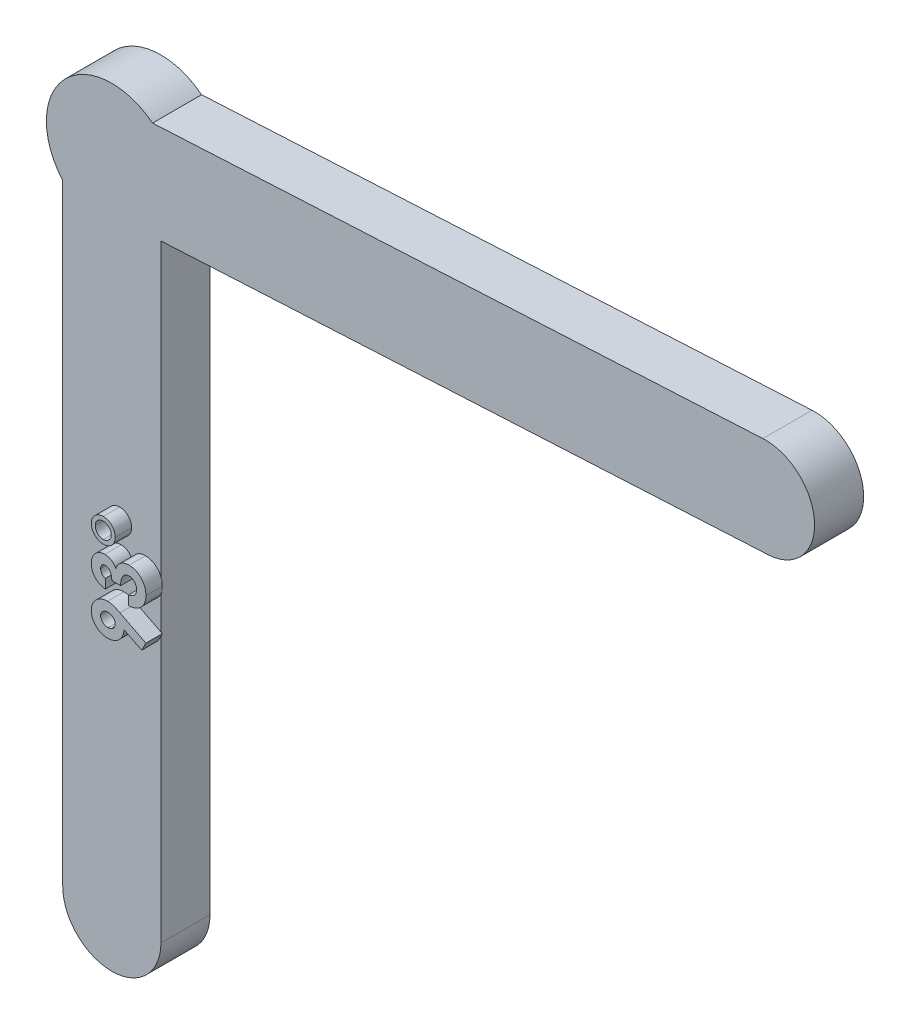
from build123d import *

# Parameters (mm, degrees)
BOSS_EXTRUDE1_DEPTH = 3
BOSS_EXTRUDE2_DEPTH = 1


with BuildPart() as part:
    # Sketch2 → Boss-Extrude1 (new body)
    with BuildSketch(Plane.XY):
        with BuildLine():
            Line((-3, -40), (-3, -2.645751311))
            ThreePointArc((-3, -2.645751311), (-2.901497484, 2.753418303), (2.485117532, 3.134356529))
            Line((2.485117532, 3.134356529), (39.788173521, 5.089326854))
            ThreePointArc((39.788173521, 5.089326854), (42.941069994, 2.250446118), (40.102189259, -0.902450355))
            Line((40.102189259, -0.902450355), (3, -2.8468937))
            Line((3, -2.8468937), (3, -40))
            ThreePointArc((3, -40), (0, -43), (-3, -40))
        make_face()
    extrude(amount=BOSS_EXTRUDE1_DEPTH)

    # Sketch3 → Boss-Extrude2 (add)
    # profile 1 of 3: a face of its own
    with BuildSketch(Plane.XY.offset(3)):
        with BuildLine():
            Line((3.081410256, -23.588450856), (2.827003205, -24.093448853))
            Line((2.827003205, -24.093448853), (1.738141026, -23.540113517))
            add(Edge.make_bspline(
                [(1.738141026, -23.540113517), (1.737307679, -23.572805789), (1.735671617, -23.636988628), (1.722077887, -23.731493709), (1.698867665, -23.821863322), (1.66798568, -23.909178369), (1.626522834, -23.992172899), (1.577200392, -24.072187069), (1.517036085, -24.147131646), (1.450419163, -24.218801512), (1.376587483, -24.283632398), (1.297699676, -24.340888916), (1.214515018, -24.38937147), (1.126474523, -24.428291226), (1.034455588, -24.458858968), (0.938097245, -24.481404343), (0.837028859, -24.494018206), (0.768247832, -24.495784735), (0.733233173, -24.49668403)],
                knots=[0, 0, 0, 0, 1.014438208, 1.991587644, 2.955575466, 3.906834206, 4.860343588, 5.829907848, 6.818577787, 7.838125475, 8.863876483, 9.862937823, 10.859547262, 11.846397878, 12.845242478, 13.865236027, 14.913246352, 16, 16, 16, 16], degree=3))
            add(Edge.make_bspline(
                [(0.733233173, -24.49668403), (0.699268433, -24.495851577), (0.632341616, -24.494211245), (0.534122537, -24.480561221), (0.439788191, -24.458163532), (0.349312599, -24.4271398), (0.263156461, -24.386739892), (0.180806411, -24.33792907), (0.102577428, -24.279980234), (0.029488987, -24.213369155), (-0.037683266, -24.141197254), (-0.095496052, -24.063553343), (-0.145955203, -23.983424749), (-0.185821936, -23.898607341), (-0.218223882, -23.810676887), (-0.240134192, -23.71842424), (-0.253941767, -23.622791914), (-0.255580842, -23.557757944), (-0.256410256, -23.524849094)],
                knots=[0, 0, 0, 0, 1.055350394, 2.079546115, 3.075301024, 4.065173222, 5.046874257, 6.027823047, 7.036058964, 8.067100199, 9.097720188, 10.095392023, 11.071904115, 12.035727154, 13.002945728, 13.979480054, 14.977565287, 16, 16, 16, 16], degree=3))
            add(Edge.make_bspline(
                [(-0.256410256, -23.524849094), (-0.25570183, -23.490446775), (-0.254308805, -23.422799269), (-0.238947683, -23.323769236), (-0.215359574, -23.22903349), (-0.183397712, -23.138149676), (-0.139790653, -23.052559556), (-0.088562765, -22.970632284), (-0.026527751, -22.893955655), (0.04326259, -22.822136546), (0.119819456, -22.757480806), (0.199293738, -22.699836555), (0.281930305, -22.65083709), (0.367786702, -22.611696418), (0.456273003, -22.580574329), (0.547584954, -22.559368449), (0.641632797, -22.54525276), (0.705408393, -22.543649359), (0.737685296, -22.542837876)],
                knots=[0, 0, 0, 0, 1.062709067, 2.08967359, 3.089490552, 4.078335371, 5.060205664, 6.052952122, 7.060109841, 8.102908433, 9.144326257, 10.153805576, 11.135063239, 12.108674621, 13.066249871, 14.029571809, 15.002763993, 16, 16, 16, 16], degree=3))
            add(Edge.make_bspline(
                [(0.737685296, -22.542837876), (0.762301574, -22.543283556), (0.81188429, -22.544181255), (0.886036554, -22.552897938), (0.960379342, -22.566305079), (1.022999032, -22.581940791), (1.075997682, -22.597668262), (1.120830704, -22.614022202), (1.170788936, -22.633745819), (1.22594926, -22.656574782), (1.286038418, -22.682692504), (1.350847586, -22.71298924), (1.421369847, -22.745551438), (1.469590593, -22.769556938), (1.494546274, -22.781980504)],
                knots=[0, 0, 0, 0, 1.105166677, 2.22605417, 3.348517788, 4.496260522, 5.122810462, 5.830557215, 6.638607343, 7.535109037, 8.511576286, 9.580928918, 10.748058253, 12, 12, 12, 12], degree=3))
            Line((1.494546274, -22.781980504), (3.081410256, -23.588450856))
        make_face()
        with BuildLine():
            add(Edge.make_bspline(
                [(1.208974359, -23.512128741), (1.207369342, -23.484820582), (1.204233503, -23.431466622), (1.179911618, -23.354865832), (1.138417283, -23.286036038), (1.082521415, -23.225660183), (1.015324017, -23.175399868), (0.938975473, -23.138571755), (0.854691699, -23.116243683), (0.795913949, -23.113910303), (0.765670072, -23.112709671)],
                knots=[0, 0, 0, 0, 0.984989413, 1.924446292, 2.868477643, 3.865502828, 4.877610339, 5.88087679, 6.909612885, 8, 8, 8, 8], degree=3))
            add(Edge.make_bspline(
                [(0.765670072, -23.112709671), (0.734793399, -23.114145334), (0.674730896, -23.116938041), (0.588284104, -23.139650292), (0.510141331, -23.178460959), (0.442213741, -23.231260652), (0.385367027, -23.292903605), (0.343842032, -23.361835986), (0.318164307, -23.436383973), (0.315039952, -23.487973789), (0.313461538, -23.514036794)],
                knots=[0, 0, 0, 0, 1.104110315, 2.147758178, 3.172670271, 4.206310416, 5.210906102, 6.157051016, 7.068948237, 8, 8, 8, 8], degree=3))
            add(Edge.make_bspline(
                [(0.313461538, -23.514036794), (0.315003347, -23.541581021), (0.318030676, -23.595663884), (0.343602738, -23.673290534), (0.384431439, -23.744526021), (0.44077104, -23.807677424), (0.508416133, -23.861065005), (0.586808982, -23.899026366), (0.672697468, -23.922819869), (0.732861373, -23.925457518), (0.763762019, -23.926812235)],
                knots=[0, 0, 0, 0, 0.970853505, 1.906262912, 2.855477211, 3.852937491, 4.877462982, 5.878766514, 6.910518104, 8, 8, 8, 8], degree=3))
            add(Edge.make_bspline(
                [(0.763762019, -23.926812235), (0.794228566, -23.92540494), (0.853482819, -23.922667898), (0.938337992, -23.899613919), (1.0154379, -23.862415398), (1.082728129, -23.810529662), (1.138908417, -23.748133904), (1.179920426, -23.676210785), (1.204301458, -23.596348705), (1.207388686, -23.540707414), (1.208974359, -23.512128741)],
                knots=[0, 0, 0, 0, 1.075841396, 2.092399178, 3.084869331, 4.085011737, 5.078048045, 6.03490933, 6.990683323, 8, 8, 8, 8], degree=3))
        make_face(mode=Mode.SUBTRACT)
    # profile 2 of 3: a face of its own
    with BuildSketch(Plane.XY.offset(3)):
        with BuildLine():
            Line((0.598397436, -21.403094286), (0.598397436, -21.972966081))
            add(Edge.make_bspline(
                [(0.598397436, -21.972966081), (0.569905344, -21.968967669), (0.514253238, -21.961157781), (0.433490113, -21.941958929), (0.35669034, -21.919756621), (0.284266078, -21.891363009), (0.216295401, -21.858587706), (0.152717485, -21.820367255), (0.092619933, -21.778475108), (0.05660533, -21.745676177), (0.038701923, -21.729371329)],
                knots=[0, 0, 0, 0, 1.1115466, 2.171125598, 3.205689823, 4.19946166, 5.17440286, 6.118867946, 7.064860634, 8, 8, 8, 8], degree=3))
            add(Edge.make_bspline(
                [(0.038701923, -21.729371329), (0.015043155, -21.705911747), (-0.031585791, -21.659675376), (-0.09131232, -21.582408976), (-0.14300157, -21.501419521), (-0.18398118, -21.41508273), (-0.217149428, -21.324742069), (-0.239428614, -21.229679117), (-0.254211051, -21.130282337), (-0.255667173, -21.062456539), (-0.256410256, -21.027843885)],
                knots=[0, 0, 0, 0, 1.01925491, 2.00884431, 2.983262333, 3.955970413, 4.92937149, 5.924503185, 6.940838805, 8, 8, 8, 8], degree=3))
            add(Edge.make_bspline(
                [(-0.256410256, -21.027843885), (-0.25568378, -20.997071455), (-0.254255673, -20.936579058), (-0.242791605, -20.847670455), (-0.222684907, -20.762903542), (-0.19639585, -20.681382309), (-0.160625195, -20.604305667), (-0.119103078, -20.52997246), (-0.068174475, -20.460459561), (-0.01063028, -20.395604322), (0.0516094, -20.336022415), (0.1181385, -20.284424223), (0.187179874, -20.240064332), (0.259307125, -20.203517648), (0.3346423, -20.175418215), (0.4127502, -20.155916375), (0.493458473, -20.143151948), (0.548314798, -20.141880277), (0.576136819, -20.141235312)],
                knots=[0, 0, 0, 0, 1.091422571, 2.145516843, 3.172569842, 4.178562979, 5.178154469, 6.181868002, 7.194278174, 8.227918432, 9.254613415, 10.245994977, 11.209837596, 12.161663635, 13.10878368, 14.055455738, 15.013766427, 16, 16, 16, 16], degree=3))
            add(Edge.make_bspline(
                [(0.576136819, -20.141235312), (0.610585958, -20.142584303), (0.678613472, -20.145248187), (0.777980899, -20.166315604), (0.8727781, -20.200182678), (0.961881861, -20.248336638), (1.045199363, -20.308807492), (1.1198207, -20.382963534), (1.186901514, -20.468735364), (1.222951204, -20.53312363), (1.241411258, -20.566095087)],
                knots=[0, 0, 0, 0, 0.992776698, 1.96045919, 2.915875678, 3.886951799, 4.871409521, 5.874469288, 6.911574252, 8, 8, 8, 8], degree=3))
            add(Edge.make_bspline(
                [(1.241411258, -20.566095087), (1.248840578, -20.543463138), (1.26343886, -20.498992374), (1.292207769, -20.435795275), (1.323580612, -20.375652592), (1.360205051, -20.319939768), (1.399542556, -20.267129011), (1.44370819, -20.218891181), (1.491568291, -20.173977176), (1.543631999, -20.133498114), (1.599033683, -20.097307955), (1.656777581, -20.065413922), (1.717074737, -20.038648834), (1.779482048, -20.016185029), (1.844613707, -19.999045768), (1.912248991, -19.986987677), (1.982224933, -19.980015534), (2.02963392, -19.978952374), (2.053605769, -19.978414799)],
                knots=[0, 0, 0, 0, 1.059375415, 2.081625174, 3.086260357, 4.075579879, 5.045586876, 6.014170127, 6.982201689, 7.963705737, 8.945119069, 9.924852636, 10.896327119, 11.878239286, 12.873838556, 13.889973282, 14.933087432, 16, 16, 16, 16], degree=3))
            add(Edge.make_bspline(
                [(2.053605769, -19.978414799), (2.088834625, -19.979504626), (2.158298755, -19.981653544), (2.260612118, -19.995315693), (2.358159557, -20.020751163), (2.452060019, -20.054216208), (2.541114181, -20.09884269), (2.627316675, -20.151405589), (2.707744153, -20.215744211), (2.783940091, -20.287893942), (2.853551958, -20.367602087), (2.915054815, -20.453373222), (2.965754166, -20.545373525), (3.00908881, -20.641378781), (3.04124993, -20.74355178), (3.064801955, -20.850570839), (3.079131724, -20.963217452), (3.080639979, -21.040097913), (3.081410256, -21.079361313)],
                knots=[0, 0, 0, 0, 1.005228408, 1.982105694, 2.937129188, 3.876607107, 4.82066901, 5.774063015, 6.75178259, 7.752926466, 8.764612432, 9.766578198, 10.757677051, 11.756882247, 12.76686714, 13.807379907, 14.880213281, 16, 16, 16, 16], degree=3))
            add(Edge.make_bspline(
                [(3.081410256, -21.079361313), (3.080599988, -21.116504647), (3.079015615, -21.189133521), (3.065302063, -21.295368449), (3.043180991, -21.396334693), (3.011999506, -21.492289919), (2.971562448, -21.582862885), (2.923410986, -21.668874941), (2.864767854, -21.748609737), (2.798280315, -21.822955674), (2.723685071, -21.890263535), (2.642710085, -21.950420912), (2.555047441, -22.002101325), (2.46107167, -22.045516715), (2.360617912, -22.080327672), (2.253890444, -22.107786453), (2.140680753, -22.126966861), (2.062790077, -22.132808294), (2.023076923, -22.135786594)],
                knots=[0, 0, 0, 0, 1.066544725, 2.085487077, 3.070979577, 4.031932826, 4.977951092, 5.916076795, 6.857635327, 7.814973522, 8.776389752, 9.738577119, 10.707772778, 11.69409279, 12.707140348, 13.757286496, 14.856535458, 16, 16, 16, 16], degree=3))
            Line((2.023076923, -22.135786594), (2.023076923, -21.565914799))
            add(Edge.make_bspline(
                [(2.023076923, -21.565914799), (2.043044885, -21.562302876), (2.081937728, -21.55526771), (2.138251456, -21.541558457), (2.190212049, -21.523646403), (2.23820125, -21.503167609), (2.282711557, -21.480525899), (2.322552685, -21.45347298), (2.359290392, -21.424466249), (2.401517912, -21.380862524), (2.445802396, -21.320025337), (2.485022762, -21.237655363), (2.507328862, -21.145608571), (2.510104057, -21.081389241), (2.511538462, -21.048196449)],
                knots=[0, 0, 0, 0, 0.928450228, 1.808400301, 2.64896863, 3.43999153, 4.194978884, 4.9294959, 5.640047715, 6.332896648, 7.70085756, 9.063442004, 10.482192841, 12, 12, 12, 12], degree=3))
            add(Edge.make_bspline(
                [(2.511538462, -21.048196449), (2.511234698, -21.030580743), (2.510639692, -20.996075515), (2.504104723, -20.945379536), (2.493216621, -20.897133951), (2.478821118, -20.850938099), (2.4592865, -20.807517963), (2.436616641, -20.765890434), (2.4088653, -20.72681679), (2.377245282, -20.690524651), (2.343480924, -20.656748783), (2.306533866, -20.627908103), (2.268178179, -20.603008504), (2.227399343, -20.583361044), (2.185484675, -20.566917336), (2.141101944, -20.556661651), (2.095214543, -20.548964589), (2.063816677, -20.548514847), (2.047881611, -20.548286594)],
                knots=[0, 0, 0, 0, 1.110702965, 2.175618623, 3.217100552, 4.227908035, 5.221854906, 6.215531843, 7.213608581, 8.237687243, 9.249555755, 10.220750668, 11.188994735, 12.127982202, 13.071814005, 14.022160605, 14.996205625, 16, 16, 16, 16], degree=3))
            add(Edge.make_bspline(
                [(2.047881611, -20.548286594), (2.030448232, -20.548867035), (1.995950897, -20.550015618), (1.945396706, -20.560123094), (1.896579334, -20.575252494), (1.849901563, -20.597011379), (1.80563791, -20.625483849), (1.763421781, -20.660103452), (1.723589285, -20.701183367), (1.684980341, -20.747347937), (1.651182253, -20.800459823), (1.620059269, -20.858374281), (1.595277703, -20.922518085), (1.57314858, -20.991352413), (1.556984463, -21.066171515), (1.545248131, -21.146513047), (1.536512134, -21.232246748), (1.535258821, -21.29134413), (1.534615385, -21.32168403)],
                knots=[0, 0, 0, 0, 0.809868251, 1.602574917, 2.388262527, 3.182133002, 3.988875265, 4.829537611, 5.714850619, 6.646378958, 7.622533229, 8.636771727, 9.698525113, 10.814716514, 11.996253919, 13.252421425, 14.589425562, 16, 16, 16, 16], degree=3))
            Line((1.534615385, -21.32168403), (1.005448718, -21.32168403))
            add(Edge.make_bspline(
                [(1.005448718, -21.32168403), (1.0022437, -21.283904446), (0.996247747, -21.213226326), (0.982028627, -21.115188777), (0.963634458, -21.032372777), (0.939661871, -20.96383172), (0.911660162, -20.905977202), (0.879215485, -20.856145419), (0.841958845, -20.812668682), (0.799944528, -20.776907251), (0.755904956, -20.747105361), (0.709066574, -20.726704395), (0.661292945, -20.713030222), (0.628592786, -20.711744288), (0.612389824, -20.711107106)],
                knots=[0, 0, 0, 0, 1.700711886, 3.181695139, 4.441392523, 5.500267777, 6.431839453, 7.31822765, 8.161090383, 8.990537424, 9.787217293, 10.536619396, 11.274893404, 12, 12, 12, 12], degree=3))
            add(Edge.make_bspline(
                [(0.612389824, -20.711107106), (0.591714502, -20.71220187), (0.551360652, -20.714338616), (0.493502791, -20.731259217), (0.441654003, -20.759974178), (0.396394238, -20.798935803), (0.359475255, -20.846800583), (0.332017035, -20.902195348), (0.315998921, -20.964839404), (0.314326488, -21.008882015), (0.313461538, -21.031659991)],
                knots=[0, 0, 0, 0, 1.009324788, 1.969988301, 2.915956825, 3.885795408, 4.868116622, 5.850437836, 6.888288533, 8, 8, 8, 8], degree=3))
            add(Edge.make_bspline(
                [(0.313461538, -21.031659991), (0.314477881, -21.052308109), (0.316494615, -21.093280298), (0.331546985, -21.153193902), (0.356885777, -21.210091864), (0.391826478, -21.26279599), (0.433788778, -21.310545482), (0.483484413, -21.34973404), (0.537936031, -21.382329224), (0.578164626, -21.396145464), (0.598397436, -21.403094286)],
                knots=[0, 0, 0, 0, 0.98818071, 1.960853194, 2.938124878, 3.957524365, 4.978590984, 5.968022688, 6.978025184, 8, 8, 8, 8], degree=3))
        make_face()
    # profile 3 of 3: a face of its own
    with BuildSketch(Plane.XY.offset(3)):
        with BuildLine():
            add(Edge.make_bspline(
                [(0.476282051, -18.187389158), (0.501543872, -18.187935652), (0.55122174, -18.189010345), (0.624352745, -18.199443644), (0.694208258, -18.21692286), (0.761803607, -18.239333507), (0.825395964, -18.270472258), (0.886396731, -18.307334006), (0.943669883, -18.351832841), (0.9978957, -18.401445138), (1.047295391, -18.455945301), (1.090947065, -18.513835657), (1.127096601, -18.575294637), (1.157366856, -18.639007417), (1.180332148, -18.705838832), (1.196689885, -18.775294755), (1.20741609, -18.847667155), (1.208449037, -18.89693404), (1.208974359, -18.921989518)],
                knots=[0, 0, 0, 0, 1.048753193, 2.062393874, 3.059725798, 4.03711221, 5.013824111, 5.993903926, 6.992478922, 8.020738441, 9.043061753, 10.043343452, 11.026424807, 11.999358773, 12.968420071, 13.955122655, 14.960044262, 16, 16, 16, 16], degree=3))
            add(Edge.make_bspline(
                [(1.208974359, -18.921989518), (1.208454225, -18.947046851), (1.207431478, -18.996317383), (1.196631189, -19.068663297), (1.180530583, -19.138285312), (1.156529218, -19.20482186), (1.126678292, -19.268586699), (1.090260147, -19.329502986), (1.046482503, -19.387031162), (0.996781055, -19.441012966), (0.942375086, -19.490537807), (0.88420218, -19.533913081), (0.823225465, -19.571376285), (0.758107997, -19.600267606), (0.69067286, -19.624377207), (0.619758864, -19.640418009), (0.545943315, -19.651263274), (0.495615647, -19.652263254), (0.469921875, -19.652773773)],
                knots=[0, 0, 0, 0, 1.037227242, 2.039512271, 3.023626077, 3.993053151, 4.963434463, 5.936395473, 6.927031705, 7.952593414, 8.972234493, 9.969891786, 10.954906455, 11.929570282, 12.915563215, 13.916770353, 14.936449251, 16, 16, 16, 16], degree=3))
            add(Edge.make_bspline(
                [(0.469921875, -19.652773773), (0.445290866, -19.65224162), (0.396869022, -19.651195466), (0.325492116, -19.640533829), (0.256787066, -19.623612944), (0.190979117, -19.599245399), (0.128167681, -19.568160417), (0.067236284, -19.531610304), (0.010175979, -19.486367581), (-0.044275745, -19.435945891), (-0.093962638, -19.380648677), (-0.137555056, -19.321952549), (-0.173973759, -19.260452189), (-0.203993097, -19.196564592), (-0.227847104, -19.130198731), (-0.244158222, -19.060841388), (-0.254789074, -18.989101702), (-0.255866772, -18.940260181), (-0.256410256, -18.915629342)],
                knots=[0, 0, 0, 0, 1.027628768, 2.020204677, 3.0054932, 3.977172113, 4.942988595, 5.928118098, 6.937247537, 7.976812879, 9.023474825, 10.036014018, 11.024160528, 12.002107364, 12.979092523, 13.962271943, 14.972371232, 16, 16, 16, 16], degree=3))
            add(Edge.make_bspline(
                [(-0.256410256, -18.915629342), (-0.255881051, -18.890996341), (-0.254836181, -18.842360577), (-0.244068832, -18.770857315), (-0.227959354, -18.701870672), (-0.203981879, -18.635954399), (-0.173948227, -18.572715286), (-0.137706982, -18.511931501), (-0.093944483, -18.454372017), (-0.043999627, -18.400449434), (0.009956511, -18.350217351), (0.068273488, -18.307057761), (0.128824771, -18.269534843), (0.192846684, -18.239885233), (0.259342082, -18.215825064), (0.329176204, -18.199664146), (0.401748506, -18.188973725), (0.451226198, -18.18792184), (0.476282051, -18.187389158)],
                knots=[0, 0, 0, 0, 1.02774298, 2.029191086, 3.012479778, 3.981238486, 4.951290381, 5.931946007, 6.930416638, 7.964088953, 8.997761269, 10.003308488, 10.98854748, 11.966603007, 12.943696749, 13.935593372, 14.954569896, 16, 16, 16, 16], degree=3))
        make_face()
        with BuildLine():
            add(Edge.make_bspline(
                [(0.479462139, -18.431619927), (0.462471258, -18.431854432), (0.428972226, -18.432316781), (0.379883793, -18.439936146), (0.332524379, -18.450453944), (0.287283463, -18.465714089), (0.24427911, -18.485664453), (0.203398935, -18.510001997), (0.164484674, -18.538605068), (0.128492582, -18.571667692), (0.095853701, -18.607534015), (0.066652511, -18.64532742), (0.042455186, -18.685516691), (0.023016589, -18.727703262), (0.006315159, -18.771232027), (-0.003707976, -18.817142093), (-0.01154919, -18.864693467), (-0.011966436, -18.897149066), (-0.012179487, -18.913721289)],
                knots=[0, 0, 0, 0, 1.061159961, 2.092171217, 3.098605391, 4.092036902, 5.070589041, 6.057187883, 7.061962211, 8.084674938, 9.107387665, 10.090954379, 11.06617917, 12.032717429, 12.99305519, 13.973669989, 14.965331307, 16, 16, 16, 16], degree=3))
            add(Edge.make_bspline(
                [(-0.012179487, -18.913721289), (-0.01157068, -18.930481581), (-0.01036426, -18.963693965), (-0.004409395, -19.012631), (0.007572839, -19.059283879), (0.022606002, -19.104485131), (0.043122897, -19.147328311), (0.067542797, -19.188821404), (0.096744971, -19.22786553), (0.129769422, -19.264644834), (0.165718261, -19.298390632), (0.204573602, -19.327380715), (0.244977971, -19.352782577), (0.287582445, -19.37288553), (0.331832846, -19.388997903), (0.377821945, -19.400639595), (0.425871214, -19.406786491), (0.458458137, -19.407951341), (0.475010016, -19.408543004)],
                knots=[0, 0, 0, 0, 1.042034071, 2.064906527, 3.055369705, 4.030203466, 5.020228521, 6.000742353, 7.017744738, 8.043920206, 9.069249762, 10.075703201, 11.051782302, 12.029903876, 12.99669358, 13.974371501, 14.971122288, 16, 16, 16, 16], degree=3))
            add(Edge.make_bspline(
                [(0.475010016, -19.408543004), (0.491349767, -19.407950314), (0.523514051, -19.406783624), (0.570936909, -19.400653331), (0.616468237, -19.388896008), (0.660506807, -19.372855568), (0.703332854, -19.352888552), (0.743356347, -19.326659428), (0.782721478, -19.297449349), (0.819574977, -19.263368492), (0.853594861, -19.226488887), (0.883277913, -19.18699337), (0.908722399, -19.146052572), (0.929101491, -19.103066515), (0.945194342, -19.058803923), (0.956841315, -19.012818121), (0.962986781, -18.964767958), (0.964151827, -18.932181159), (0.96474359, -18.915629342)],
                knots=[0, 0, 0, 0, 1.017878107, 2.003660885, 2.970612419, 3.939454555, 4.919652619, 5.904816436, 6.913406512, 7.969270601, 9.02513469, 10.033724766, 11.041277553, 12.021475617, 12.990317753, 13.970071221, 14.968938047, 16, 16, 16, 16], degree=3))
            add(Edge.make_bspline(
                [(0.96474359, -18.915629342), (0.964515736, -18.899270856), (0.964066668, -18.867030536), (0.956359019, -18.819879058), (0.946146284, -18.774219457), (0.929505189, -18.730915821), (0.910263551, -18.688464067), (0.884925795, -18.648682663), (0.856415485, -18.609826473), (0.822504018, -18.574499826), (0.787116244, -18.540383007), (0.747777121, -18.512195723), (0.707718654, -18.486950317), (0.665616684, -18.466300229), (0.621397497, -18.45149277), (0.575848465, -18.439369649), (0.528165265, -18.433439615), (0.49579822, -18.43223029), (0.479462139, -18.431619927)],
                knots=[0, 0, 0, 0, 1.029744634, 2.029484694, 3.00508751, 3.97324883, 4.947661161, 5.937798898, 6.940036528, 7.980134083, 9.020231638, 10.033191535, 11.023329272, 12.003497406, 12.979740652, 13.958541426, 14.969648588, 16, 16, 16, 16], degree=3))
        make_face(mode=Mode.SUBTRACT)
    extrude(amount=BOSS_EXTRUDE2_DEPTH)


solid = part.part
